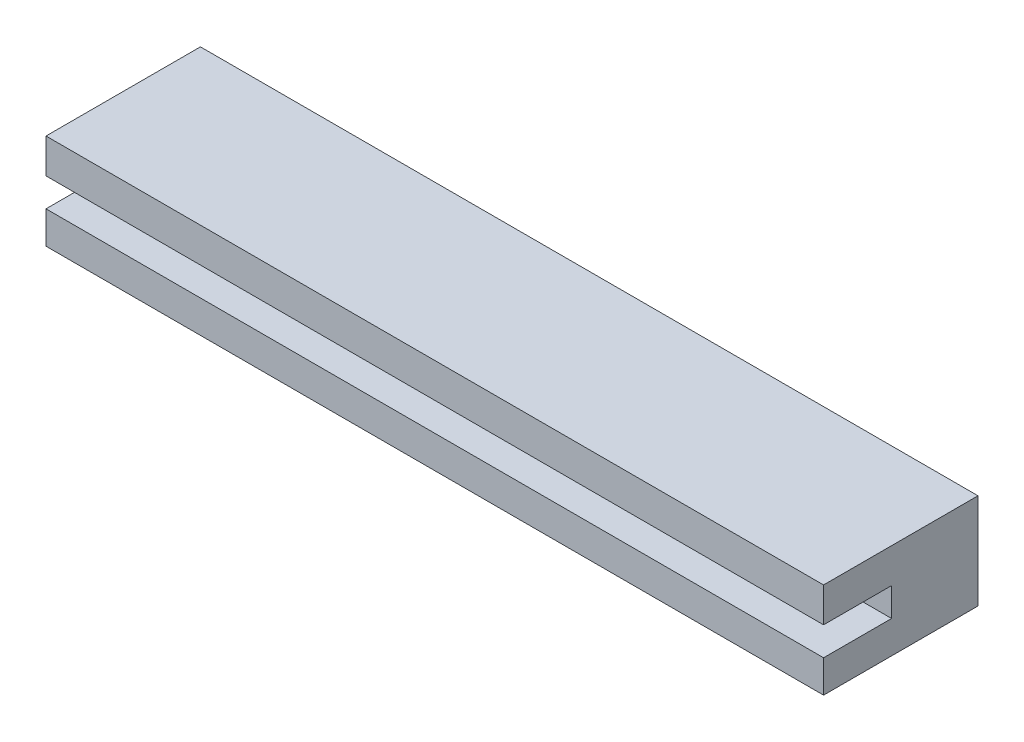
from build123d import *

# Parameters (mm, degrees)
SKETCH1_W           = 4
SKETCH1_H           = 2.032
SKETCH1_W_2         = 5.08
SKETCH1_H_2         = 5.6134
SKETCH1_H_3         = 1.905
BOSS_EXTRUDE1_DEPTH = 45.72


with BuildPart() as part:
    # Sketch1 → Boss-Extrude1 (new body)
    with BuildSketch(Plane(origin=(0, 0, 0), x_dir=(0, 0, -1), z_dir=(1, 0, 0))):
        with Locations((2, -1.016)):
            Rectangle(SKETCH1_W, SKETCH1_H)
        with Locations((6.54, -2.8067)):
            Rectangle(SKETCH1_W_2, SKETCH1_H_2)
        with Locations((2, -4.6609)):
            Rectangle(SKETCH1_W, SKETCH1_H_3)
    extrude(amount=BOSS_EXTRUDE1_DEPTH)


solid = part.part
